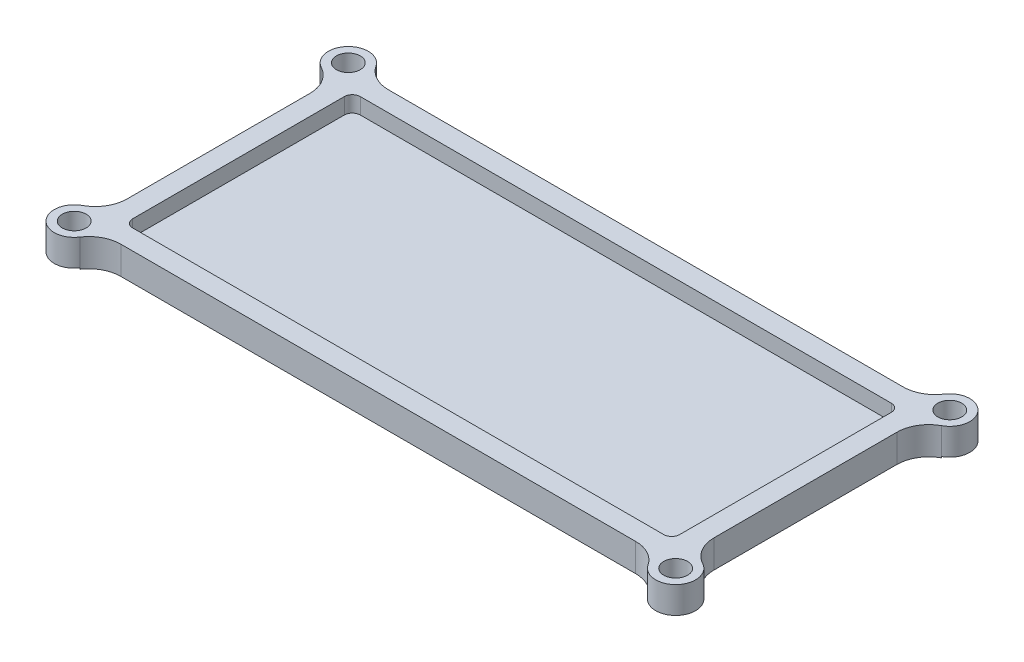
from build123d import *

# Parameters (mm, degrees)
SKETCH1_R                                      = 2.5
SKETCH1_R_2                                    = 1
SKETCH1_W                                      = 73.5
SKETCH1_H                                      = 33.5
BOSS_EXTRUDE1_DEPTH                            = 1.5
SKETCH2_R                                      = 1
SKETCH2_W                                      = 68.5
SKETCH2_H                                      = 28.5
BOSS_EXTRUDE2_DEPTH                            = 2
FILLET1_R                                      = 4
CSK_FOR_M2_5_FLAT_HEAD_MACHINE_SCREW1_AT_COUNT = 2
CSK_FOR_M2_5_FLAT_HEAD_MACHINE_SCREW1_AT_PITCH = 34.329470958
CSK_FOR_M2_5_FLAT_HEAD_MACHINE_SCREW_2_COUNT   = 2
CSK_FOR_M2_5_FLAT_HEAD_MACHINE_SCREW_2_PITCH   = 75.319884043
CSK_FOR_M2_5_FLAT_HEAD_MACHINE_SCREW_3_COUNT   = 2
CSK_FOR_M2_5_FLAT_HEAD_MACHINE_SCREW_3_PITCH   = 82.774377125
FILLET2_R                                      = 1


with BuildPart() as part:
    # Sketch1 → Boss-Extrude1 (new body)
    # profile 1 of 5: a face of its own
    with BuildSketch(Plane(origin=(0, 0, 0), x_dir=(1, 0, 0), z_dir=(0, 1, 0))):
        with Locations((-37.659942021, 17.164735479)):
            Circle(SKETCH1_R)
        with Locations(Location((-37.659942021, 17.164735479, 0), (0, 0, 270))):
            Circle(SKETCH1_R_2, mode=Mode.SUBTRACT)
    # profile 2 of 5: a face of its own
    with BuildSketch(Plane(origin=(0, 0, 0), x_dir=(1, 0, 0), z_dir=(0, 1, 0))):
        with Locations((37.659942021, 17.164735479)):
            Circle(SKETCH1_R)
        with Locations(Location((37.659942021, 17.164735479, 0), (0, 0, 270))):
            Circle(SKETCH1_R_2, mode=Mode.SUBTRACT)
    # profile 3 of 5: a face of its own
    with BuildSketch(Plane(origin=(0, 0, 0), x_dir=(1, 0, 0), z_dir=(0, 1, 0))):
        with Locations((37.659942021, -17.164735479)):
            Circle(SKETCH1_R)
        with Locations(Location((37.659942021, -17.164735479, 0), (0, 0, 270))):
            Circle(SKETCH1_R_2, mode=Mode.SUBTRACT)
    # profile 4 of 5: a face of its own
    with BuildSketch(Plane(origin=(0, 0, 0), x_dir=(1, 0, 0), z_dir=(0, 1, 0))):
        with Locations((-37.659942021, -17.164735479)):
            Circle(SKETCH1_R)
        with Locations(Location((-37.659942021, -17.164735479, 0), (0, 0, 270))):
            Circle(SKETCH1_R_2, mode=Mode.SUBTRACT)
    # profile 5 of 5: a face of its own
    with BuildSketch(Plane(origin=(0, 0, 0), x_dir=(1, 0, 0), z_dir=(0, 1, 0))):
        Rectangle(SKETCH1_W, SKETCH1_H)
    extrude(amount=BOSS_EXTRUDE1_DEPTH)

    # Sketch2 → Boss-Extrude2 (add)
    with BuildSketch(Plane(origin=(0, 1.5, 0), x_dir=(1, 0, 0), z_dir=(0, 1, 0))):
        with BuildLine():
            Line((36.75, -14.836215452), (36.75, 14.836215452))
            ThreePointArc((36.75, 14.836215452), (39.599995344, 18.741502141), (35.194583126, 16.75))
            Line((35.194583126, 16.75), (-35.194583126, 16.75))
            ThreePointArc((-35.194583126, 16.75), (-39.599995344, 18.741502141), (-36.75, 14.836215452))
            Line((-36.75, 14.836215452), (-36.75, -14.836215452))
            ThreePointArc((-36.75, -14.836215452), (-39.599995344, -18.741502141), (-35.194583126, -16.75))
            Line((-35.194583126, -16.75), (35.194583126, -16.75))
            ThreePointArc((35.194583126, -16.75), (39.599995344, -18.741502141), (36.75, -14.836215452))
        make_face()
        with Locations(Location((37.659942021, -17.164735479, 0), (0, 0, 270))):
            Circle(SKETCH2_R, mode=Mode.SUBTRACT)
        with Locations(Location((37.659942021, 17.164735479, 0), (0, 0, 270))):
            Circle(SKETCH2_R, mode=Mode.SUBTRACT)
        with Locations(Location((-37.659942021, 17.164735479, 0), (0, 0, 270))):
            Circle(SKETCH2_R, mode=Mode.SUBTRACT)
        with Locations(Location((-37.659942021, -17.164735479, 0), (0, 0, 270))):
            Circle(SKETCH2_R, mode=Mode.SUBTRACT)
        Rectangle(SKETCH2_W, SKETCH2_H, mode=Mode.SUBTRACT)
    extrude(amount=BOSS_EXTRUDE2_DEPTH)

    # Fillet1
    fillet1_edges = [part.edges().sort_by_distance(p)[0] for p in [
        (36.75, 1.75, 14.836215452),
        (35.194583126, 1.75, 16.75),
        (-35.194583126, 1.75, 16.75),
        (-36.75, 1.75, 14.836215452),
        (-36.75, 1.75, -14.836215452),
        (-35.194583126, 1.75, -16.75),
        (35.194583126, 1.75, -16.75),
        (36.75, 1.75, -14.836215452),
    ]]
    fillet(fillet1_edges, radius=FILLET1_R)

    # Sketch6 → CSK for M2.5 Flat Head Machine Screw1 (revolve, cut)
    with BuildSketch(Plane(origin=(-37.659942021, 0, 17.164735479), x_dir=(0, 0, -1), z_dir=(1, 0, 0))):
        Polygon((0, 0), (0, 3.5), (1.5, 3.5), (1.5, 1.15), (2.5, 0.15), (2.5, 0), align=None)
    csk_for_m2_5_flat_head_machine_screw1 = revolve(axis=Axis((-37.659942021, -6.35, 17.164735479), (0, 1, 0)), mode=Mode.SUBTRACT)

    # CSK for M2.5 Flat Head Machine Screw1 at: CSK for M2.5 Flat Head Machine Screw1 ×2
    with Locations(*[(0, 0, -i * CSK_FOR_M2_5_FLAT_HEAD_MACHINE_SCREW1_AT_PITCH) for i in range(1, CSK_FOR_M2_5_FLAT_HEAD_MACHINE_SCREW1_AT_COUNT)]):
        add(csk_for_m2_5_flat_head_machine_screw1, mode=Mode.SUBTRACT)

    # CSK for M2.5 Flat Head Machine Screw 2: CSK for M2.5 Flat Head Machine Screw1 ×2
    with Locations(*[(i * CSK_FOR_M2_5_FLAT_HEAD_MACHINE_SCREW_2_PITCH, 0, 0) for i in range(1, CSK_FOR_M2_5_FLAT_HEAD_MACHINE_SCREW_2_COUNT)]):
        add(csk_for_m2_5_flat_head_machine_screw1, mode=Mode.SUBTRACT)

    # CSK for M2.5 Flat Head Machine Screw 3: CSK for M2.5 Flat Head Machine Screw1 ×2
    with Locations(*[Vector(0.9099420214144476, 0, -0.4147354791480819) * (i * CSK_FOR_M2_5_FLAT_HEAD_MACHINE_SCREW_3_PITCH) for i in range(1, CSK_FOR_M2_5_FLAT_HEAD_MACHINE_SCREW_3_COUNT)]):
        add(csk_for_m2_5_flat_head_machine_screw1, mode=Mode.SUBTRACT)

    # Fillet2
    fillet2_edges = [part.edges().sort_by_distance(p)[0] for p in [
        (34.25, 2.5, 14.25),
        (34.25, 2.5, -14.25),
        (-34.25, 2.5, -14.25),
        (-34.25, 2.5, 14.25),
    ]]
    fillet(fillet2_edges, radius=FILLET2_R)


solid = part.part
